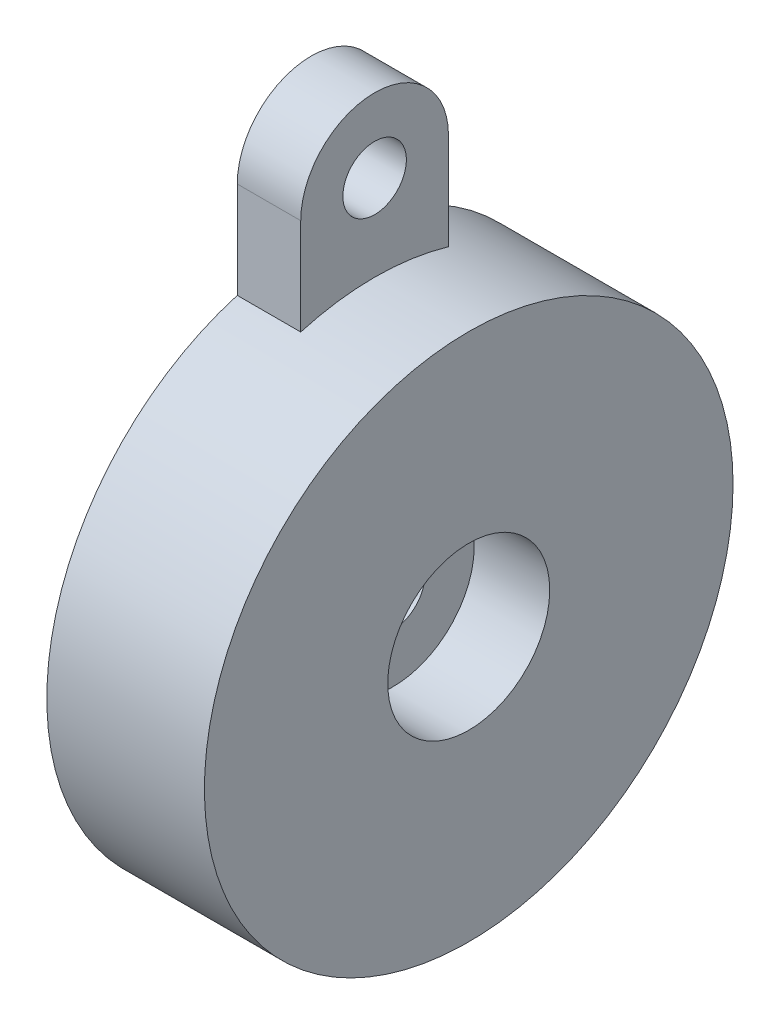
from build123d import *

# Parameters (mm, degrees)
SKETCH1_R           = 12.075
BOSS_EXTRUDE1_DEPTH = 3.6
BOSS_EXTRUDE2_DEPTH = 2.9
SKETCH3_R           = 6.125
BOSS_EXTRUDE3_DEPTH = 2.25
SKETCH4_R           = 3.0625
CUT_EXTRUDE1_DEPTH  = 4.44
SKETCH5_R           = 1.45
CUT_EXTRUDE2_DEPTH  = 24.372983335
SKETCH6_R           = 3.7
CUT_EXTRUDE3_DEPTH  = 3.45
SKETCH7_R           = 1.45
CUT_EXTRUDE4_DEPTH  = 24.938175578


with BuildPart() as part:
    # Sketch1 → Boss-Extrude1 (new, symmetric)
    with BuildSketch(Plane(origin=(0, 0, 0), x_dir=(0, 0, -1), z_dir=(1, 0, 0))):
        Circle(SKETCH1_R)
    extrude(amount=BOSS_EXTRUDE1_DEPTH, both=True)

    # Sketch2 → Boss-Extrude2 (add)
    with BuildSketch(Plane.ZY.offset(3.6)):
        with BuildLine():
            Line((-3.375, 0), (-3.375, 16))
            ThreePointArc((-3.375, 16), (0, 19.375), (3.375, 16))
            Line((3.375, 16), (3.375, 0))
            ThreePointArc((3.375, 0), (0, -3.375), (-3.375, 0))
        make_face()
    extrude(amount=-BOSS_EXTRUDE2_DEPTH)

    # Sketch3 → Boss-Extrude3 (add)
    with BuildSketch(Plane.ZY.offset(3.6)):
        Circle(SKETCH3_R)
    extrude(amount=BOSS_EXTRUDE3_DEPTH)

    # Sketch4 → Cut-Extrude1 (cut)
    with BuildSketch(Plane.ZY.offset(5.85)):
        Circle(SKETCH4_R)
    extrude(amount=-CUT_EXTRUDE1_DEPTH, mode=Mode.SUBTRACT)

    # Sketch5 → Cut-Extrude2 (cut, through all)
    with BuildSketch(Plane.ZY.offset(1.41)):
        Circle(SKETCH5_R)
    extrude(amount=-CUT_EXTRUDE2_DEPTH, mode=Mode.SUBTRACT)

    # Sketch6 → Cut-Extrude3 (cut)
    with BuildSketch(Plane(origin=(3.6, 0, 0), x_dir=(0, 0, -1), z_dir=(1, 0, 0))):
        Circle(SKETCH6_R)
    extrude(amount=-CUT_EXTRUDE3_DEPTH, mode=Mode.SUBTRACT)

    # Sketch7 → Cut-Extrude4 (cut, through all)
    with BuildSketch(Plane.ZY.offset(3.6)):
        with Locations((0, 16)):
            Circle(SKETCH7_R)
    extrude(amount=-CUT_EXTRUDE4_DEPTH, mode=Mode.SUBTRACT)


solid = part.part
